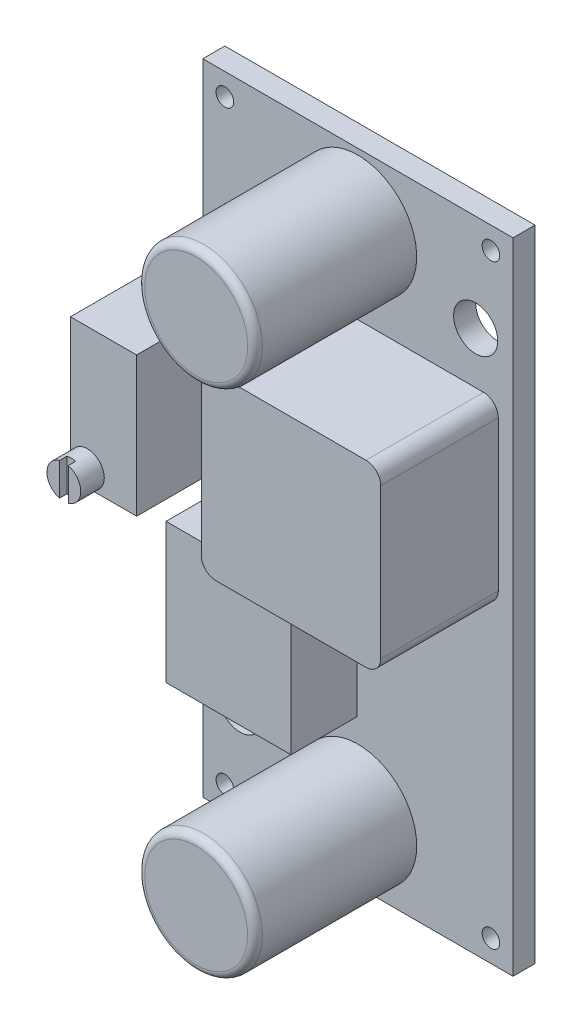
from build123d import *

# Parameters (mm, degrees)
SKETCH_1_W          = 21.1
SKETCH_1_H          = 43.5
EXTRUDE_1_DEPTH     = 1.5
SKETCH_6_R          = 1.5
SKETCH_6_R_2        = 0.6
CUT_EXTRUDE_2_DEPTH = 1.5
SKETCH_7_R          = 4
EXTRUDE_9_DEPTH     = 11
EXTRUDE_10_DEPTH    = 8
SKETCH_7_4_W        = 8.5
SKETCH_7_4_H        = 9.5
EXTRUDE_11_DEPTH    = 4.5
FILLET_1_R          = 0.5
SKETCH_4_3_W        = 4.5
SKETCH_4_3_H        = 9.5
EXTRUDE_7_DEPTH     = 10
EXTRUDE_START       = 10
SKETCH_4_3_3_R      = 1.15
EXTRUDE_8_DEPTH     = 1.6
SKETCH_5_W          = 0.6
SKETCH_5_H          = 3
CUT_EXTRUDE_1_DEPTH = 0.5


with BuildPart() as part:
    # Эскиз1 → Бобышка-Вытянуть1 (new body)
    with BuildSketch(Plane.XY):
        Rectangle(SKETCH_1_W, SKETCH_1_H)
    extrude(amount=EXTRUDE_1_DEPTH)

    # Эскиз6 → Вырез-Вытянуть2 (cut)
    with BuildSketch(Plane.XY.offset(1.5)):
        with Locations((8.01, 15.15)):
            Circle(SKETCH_6_R)
        with Locations((-8.01, -15.15)):
            Circle(SKETCH_6_R)
        with Locations((9.05, 20.25)):
            Circle(SKETCH_6_R_2)
        with Locations(Location((-9.05, 20.25, 0), (0, 0, 180))):
            Circle(SKETCH_6_R_2)
        with Locations(Location((9.05, -20.25, 0), (0, 0, 180))):
            Circle(SKETCH_6_R_2)
        with Locations((-9.05, -20.25)):
            Circle(SKETCH_6_R_2)
    extrude(amount=-CUT_EXTRUDE_2_DEPTH, mode=Mode.SUBTRACT)

    # Эскиз7 → Бобышка-Вытянуть9 (add)
    with BuildSketch(Plane.XY.offset(1.5)):
        with Locations(Location((0, 17.35, 0), (0, 0, 180))):
            Circle(SKETCH_7_R)
        with Locations((0, -17.35)):
            Circle(SKETCH_7_R)
    extrude(amount=EXTRUDE_9_DEPTH)

    # Эскиз7<3> → Бобышка-Вытянуть10 (add)
    with BuildSketch(Plane.XY.offset(1.5)):
        with BuildLine():
            ThreePointArc((8.55, 11.65), (9.257106781, 11.357106781), (9.55, 10.65))
            Line((9.55, 10.65), (9.55, 0.45))
            ThreePointArc((9.55, 0.45), (9.257106781, -0.257106781), (8.55, -0.55))
            Line((8.55, -0.55), (-1.65, -0.55))
            ThreePointArc((-1.65, -0.55), (-2.357106781, -0.257106781), (-2.65, 0.45))
            Line((-2.65, 0.45), (-2.65, 10.65))
            ThreePointArc((-2.65, 10.65), (-2.357106781, 11.357106781), (-1.65, 11.65))
            Line((-1.65, 11.65), (8.55, 11.65))
        make_face()
    extrude(amount=EXTRUDE_10_DEPTH)

    # Эскиз7<4> → Бобышка-Вытянуть11 (add)
    with BuildSketch(Plane.XY.offset(1.5)):
        with Locations((-4.3, -7)):
            Rectangle(SKETCH_7_4_W, SKETCH_7_4_H)
    extrude(amount=EXTRUDE_11_DEPTH)

    # Скругление1
    fillet_1_edges = [part.edges().sort_by_distance(p)[0] for p in [
        (4, 17.35, 12.5),
        (-4, -17.35, 12.5),
    ]]
    fillet(fillet_1_edges, radius=FILLET_1_R)



with BuildPart() as body_2:
    # Эскиз4<3> → Бобышка-Вытянуть7 (new body)
    with BuildSketch(Plane(origin=(5.475455411, 30.634305543, 1.5), x_dir=(1, 0, 0), z_dir=(0, 0, 1))):
        with Locations((-12.775455411, -23.334305543)):
            Rectangle(SKETCH_4_3_W, SKETCH_4_3_H)
    extrude(amount=EXTRUDE_7_DEPTH)


with BuildPart() as part_1:
    add(part.part)

    add(body_2.part)  # Бобышка-Вытянуть8 merges body 2
    # Эскиз4<3><3> → Бобышка-Вытянуть8 (add)
    with BuildSketch(Plane(origin=(5.475455411, 30.634305543, 1.5), x_dir=(1, 0, 0), z_dir=(0, 0, 1)).offset(EXTRUDE_START)):
        with Locations(Location((-13.875455411, -26.934305543, 0), (0, 0, 180))):
            Circle(SKETCH_4_3_3_R)
    extrude(amount=EXTRUDE_8_DEPTH)

    # Эскиз5 → Вырез-Вытянуть1 (cut)
    with BuildSketch(Plane(origin=(6.95, -7.75, 13.1), x_dir=(1, 0, 0), z_dir=(0, 0, 1))):
        with Locations((-15.35, 11.45)):
            Rectangle(SKETCH_5_W, SKETCH_5_H)
    extrude(amount=-CUT_EXTRUDE_1_DEPTH, mode=Mode.SUBTRACT)


solid = part_1.part
